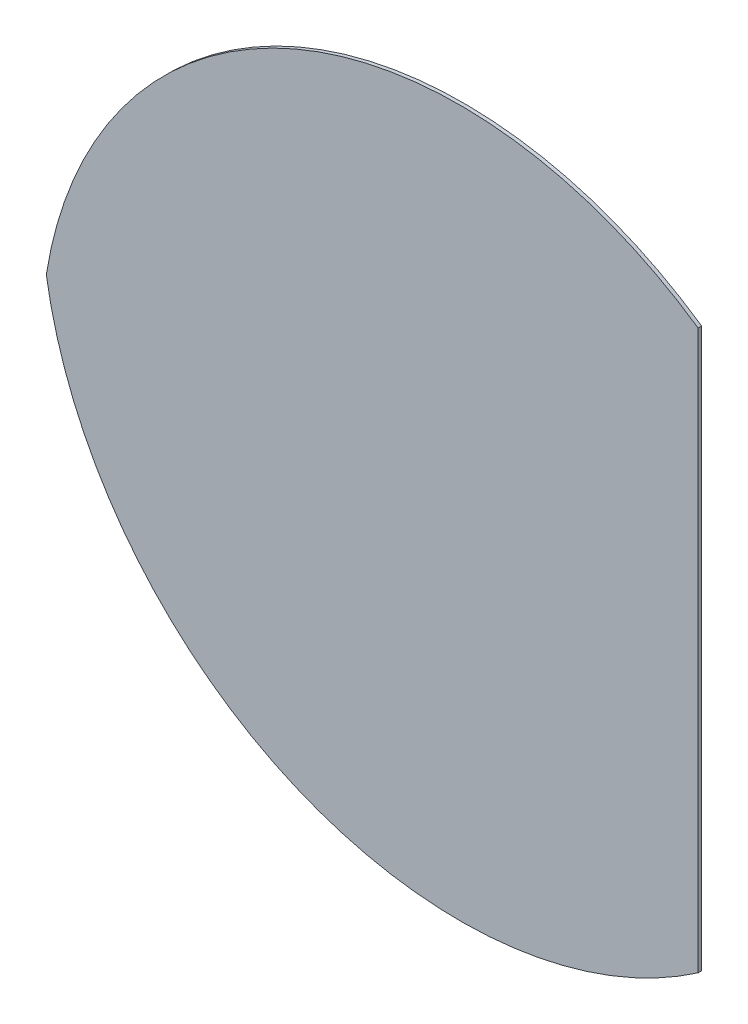
from build123d import *

# Parameters (mm, degrees)
BOSS_EXTRUDE1_DEPTH = 1


with BuildPart() as part:
    # Sketch1 → Boss-Extrude1 (new body)
    with BuildSketch(Plane.XY):
        with BuildLine():
            Line((21.196379948, 90.769077736), (21.196379951, -66.971037629))
            ThreePointArc((21.196379951, -66.971037629), (-92.5676036, -78.358146763), (-162.953509904, 11.740323822))
            ThreePointArc((-162.953509904, 11.740323822), (-92.701847917, 102.106510412), (21.196379948, 90.769077736))
        make_face()
    extrude(amount=BOSS_EXTRUDE1_DEPTH)


solid = part.part
